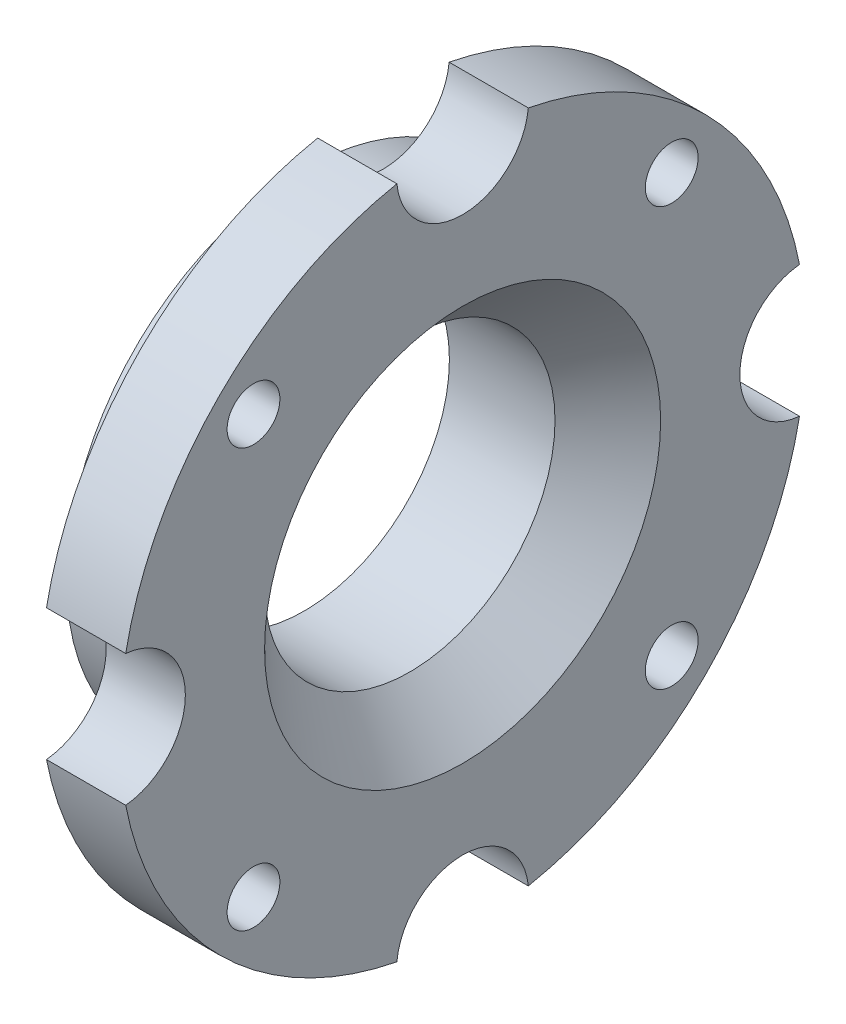
from build123d import *

# Parameters (mm, degrees)
SKETCH1_R           = 9
SKETCH1_R_2         = 5.5
BOSS_EXTRUDE1_DEPTH = 3
SKETCH2_R           = 13
SKETCH2_R_2         = 5.5
BOSS_EXTRUDE2_DEPTH = 3
SKETCH3_R           = 1
SKETCH3_R_2         = 2.5
CUT_EXTRUDE1_DEPTH  = 20.339079606
CHAMFER1_SIZE       = 2


with BuildPart() as part:
    # Sketch1 → Boss-Extrude1 (new body)
    with BuildSketch(Plane(origin=(0, 0, 0), x_dir=(0, 0, -1), z_dir=(1, 0, 0))):
        Circle(SKETCH1_R)
        Circle(SKETCH1_R_2, mode=Mode.SUBTRACT)
    extrude(amount=BOSS_EXTRUDE1_DEPTH)

    # Sketch2 → Boss-Extrude2 (add)
    with BuildSketch(Plane(origin=(3, 0, 0), x_dir=(0, 0, -1), z_dir=(1, 0, 0))):
        Circle(SKETCH2_R)
        Circle(SKETCH2_R_2, mode=Mode.SUBTRACT)
    extrude(amount=BOSS_EXTRUDE2_DEPTH)

    # Sketch3 → Cut-Extrude1 (cut, through all)
    with BuildSketch(Plane(origin=(6, 0, 0), x_dir=(0, 0, -1), z_dir=(1, 0, 0))):
        with Locations((7.919595949, 7.919595949)):
            Circle(SKETCH3_R)
        with Locations((7.919595949, -7.919595949)):
            Circle(SKETCH3_R)
        with Locations((-7.919595949, -7.919595949)):
            Circle(SKETCH3_R)
        with Locations((-7.919595949, 7.919595949)):
            Circle(SKETCH3_R)
        with Locations((0, 13)):
            Circle(SKETCH3_R_2)
        with Locations((13, 0)):
            Circle(SKETCH3_R_2)
        with Locations((0, -13)):
            Circle(SKETCH3_R_2)
        with Locations((-13, 0)):
            Circle(SKETCH3_R_2)
    extrude(amount=-CUT_EXTRUDE1_DEPTH, mode=Mode.SUBTRACT)

    # Chamfer1
    chamfer1_edges = [part.edges().sort_by_distance(p)[0] for p in [
        (6, 0, 5.5),
    ]]
    chamfer(chamfer1_edges, length=CHAMFER1_SIZE)


solid = part.part
